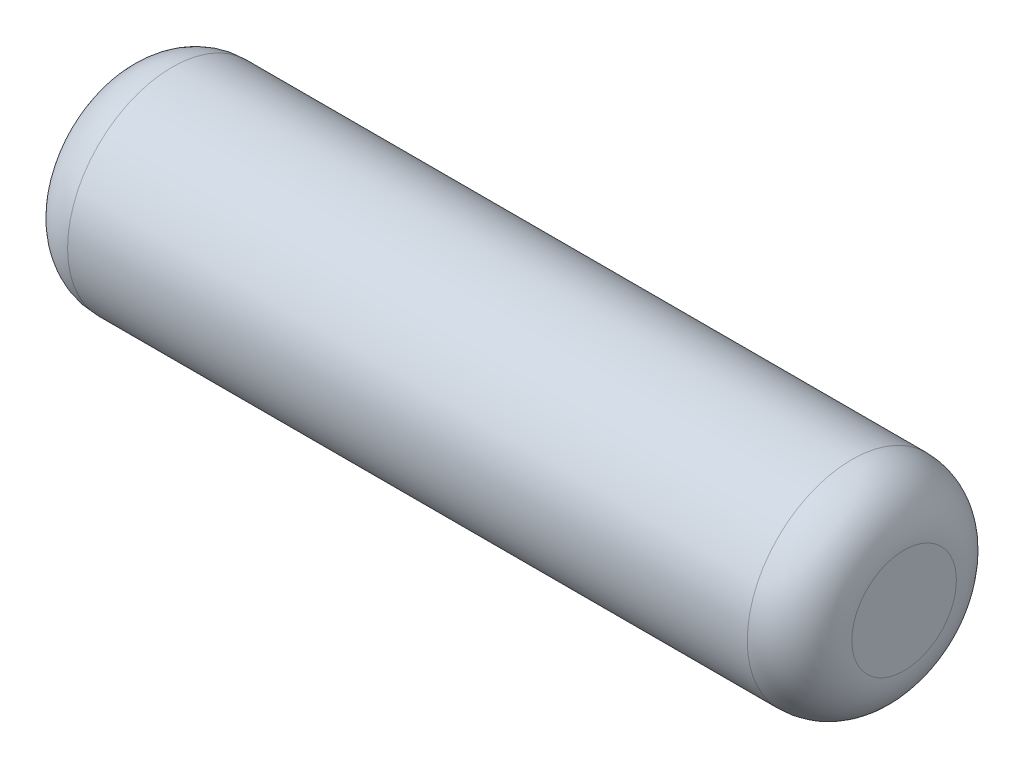
from build123d import *

# Parameters (mm, degrees)
SKETCH_1_R      = 2
EXTRUDE_1_DEPTH = 7.5
FILLET_1_R      = 1


with BuildPart() as part:
    # 草图1 → 凸台-拉伸1 (new, symmetric)
    with BuildSketch(Plane(origin=(0, 0, 0), x_dir=(0, 0, -1), z_dir=(1, 0, 0))):
        Circle(SKETCH_1_R)
    extrude(amount=EXTRUDE_1_DEPTH, both=True)

    # 圆角1
    fillet_1_edges = [part.edges().sort_by_distance(p)[0] for p in [
        (-7.5, 0, 2),
        (7.5, 0, 2),
    ]]
    fillet(fillet_1_edges, radius=FILLET_1_R)


solid = part.part
